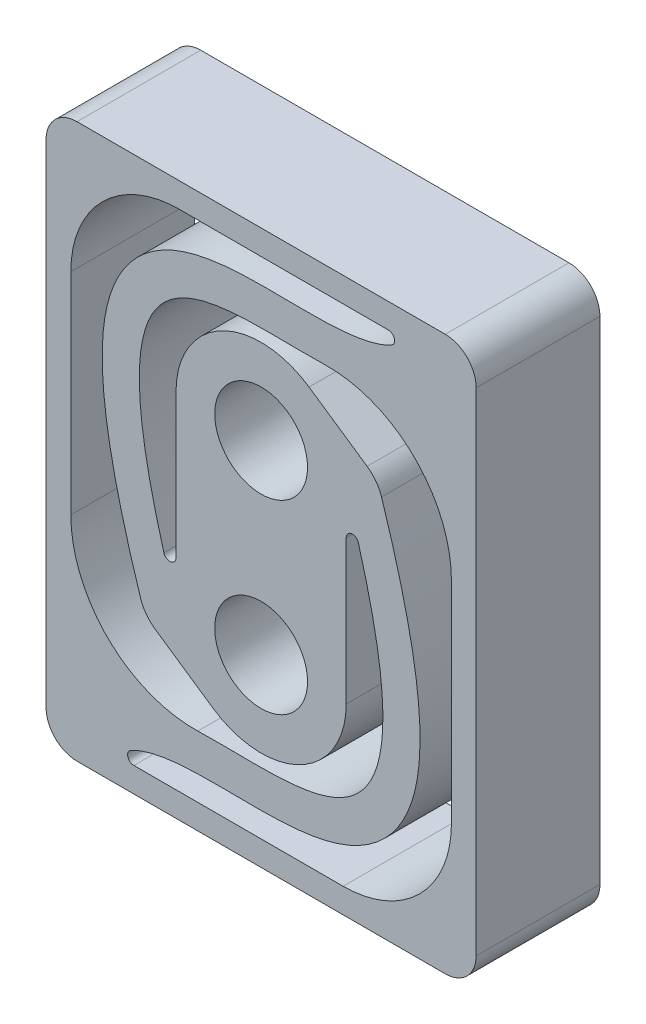
from build123d import *

# Parameters (mm, degrees)
SKETCH1_R           = 1.5
BOSS_EXTRUDE1_DEPTH = 4
SKETCH3_W           = 13.9
SKETCH3_H           = 17.9
BOSS_EXTRUDE2_DEPTH = 4
FILLET1_R           = 1


with BuildPart() as part:
    # Sketch1 → Boss-Extrude1 (new body)
    with BuildSketch(Plane.XY):
        with BuildLine():
            Line((2.75, 3), (2.75, -3))
            ThreePointArc((2.75, -3), (0, -5.75), (-2.75, -3))
            Line((-2.75, -3), (-2.75, 3))
            ThreePointArc((-2.75, 3), (0, 5.75), (2.75, 3))
        make_face()
        with Locations((0, 3)):
            Circle(SKETCH1_R, mode=Mode.SUBTRACT)
        with Locations((0, -3)):
            Circle(SKETCH1_R, mode=Mode.SUBTRACT)
    extrude(amount=BOSS_EXTRUDE1_DEPTH)

    # Sketch3 → Boss-Extrude2 (add)
    # profile 1 of 9: a face of its own
    with BuildSketch(Plane.XY):
        Rectangle(SKETCH3_W, SKETCH3_H)
        with BuildLine():
            ThreePointArc((-6.15, 4.65), (-5.124873734, 7.124873734), (-2.65, 8.15))
            Line((-2.65, 8.15), (4.112856791, 8.15))
            Line((4.112856791, 8.15), (4.706051065, 8.15))
            Line((4.706051065, 8.15), (6.15, 8.15))
            Line((6.15, 8.15), (6.15, 2.154161758))
            Line((6.15, 2.154161758), (6.15, -4.65))
            ThreePointArc((6.15, -4.65), (5.124873734, -7.124873734), (2.65, -8.15))
            Line((2.65, -8.15), (-4.112856791, -8.15))
            Line((-4.112856791, -8.15), (-4.706051065, -8.15))
            Line((-4.706051065, -8.15), (-6.15, -8.15))
            Line((-6.15, -8.15), (-6.15, -2.154161758))
            Line((-6.15, -2.154161758), (-6.15, 4.65))
        make_face(mode=Mode.SUBTRACT)
    # profile 2 of 9: a face of its own
    with BuildSketch(Plane.XY):
        with BuildLine():
            ThreePointArc((-2.75, -1.657276465), (-2.922233335, -1.855339617), (-3.142290123, -1.712271998))
            add(Edge.make_bspline(
                [(-2.75, -3), (-2.895116066, -2.548968307), (-3.025653874, -2.120086915), (-3.142290123, -1.712271998)],
                knots=[0, 0, 0, 0, 0.03046246, 0.03046246, 0.03046246, 0.03046246], degree=3))
            Line((-2.75, -3), (-2.75, -1.657276465))
        make_face()
    # profile 3 of 9: a face of its own
    with BuildSketch(Plane.XY):
        with BuildLine():
            ThreePointArc((2.75, 1.657276465), (2.922233335, 1.855339617), (3.142290123, 1.712271998))
            add(Edge.make_bspline(
                [(2.75, 3), (2.895116066, 2.548968307), (3.025653874, 2.120086915), (3.142290123, 1.712271998)],
                knots=[0, 0, 0, 0, 0.03046246, 0.03046246, 0.03046246, 0.03046246], degree=3))
            Line((2.75, 3), (2.75, 1.657276465))
        make_face()
    # profile 4 of 9: a face of its own
    with BuildSketch(Plane.XY):
        with BuildLine():
            add(Edge.make_bspline(
                [(-2.04403215, -6.152757863), (-3.725432845, -6.197317106), (-5.32078534, -6.499978045), (-6.15, -8.15)],
                knots=[0.694867205, 0.694867205, 0.694867205, 0.694867205, 1, 1, 1, 1], degree=3))
            Line((-6.15, -8.15), (-4.706051065, -8.15))
            add(Edge.make_bspline(
                [(-4.207167317, -7.773632416), (-4.252078901, -7.797648366), (-4.35473853, -7.857185348), (-4.503870008, -7.961266958), (-4.622893022, -8.065250612), (-4.688673957, -8.131740554), (-4.706051065, -8.15)],
                knots=[0.873569037, 0.873569037, 0.873569037, 0.873569037, 0.889194037, 0.910606982, 0.932019927, 0.939832427, 0.939832427, 0.939832427, 0.939832427], degree=3))
            add(Edge.make_bspline(
                [(3.892329753, 3.367536033), (3.966691683, 3.136413539), (4.114564902, 2.664320103), (4.373566525, 1.785097119), (4.645385903, 0.756379468), (4.887449448, -0.359638934), (5.104052776, -1.708671801), (5.181502836, -3.15853137), (4.962795165, -4.614749004), (4.365786787, -5.837691524), (3.403362237, -6.694112805), (2.315936187, -7.134159929), (0.867591801, -7.375395149), (-0.923730528, -7.344095734), (-2.573627433, -7.340372841), (-3.558390207, -7.511577042), (-3.980456832, -7.660053684), (-4.162255733, -7.749616466), (-4.207167317, -7.773632416)],
                knots=[0, 0, 0, 0, 0.015625, 0.03125, 0.0625, 0.09375, 0.125, 0.1875, 0.25, 0.3125, 0.375, 0.4375, 0.5, 0.625, 0.75, 0.8125, 0.857944037, 0.873569037, 0.873569037, 0.873569037, 0.873569037], degree=3))
            ThreePointArc((3.892329753, 3.367536033), (3.711332001, 3.718220568), (3.426363636, 3.991227639))
            Line((3.426363636, 3.991227639), (1.55, 5.271563338))
            ThreePointArc((1.55, 5.271563338), (2.431563283, 4.284523258), (2.75, 3))
            add(Edge.make_bspline(
                [(2.75, 3), (2.895116066, 2.548968307), (3.025653874, 2.120086915), (3.142290123, 1.712271998)],
                knots=[0, 0, 0, 0, 0.03046246, 0.03046246, 0.03046246, 0.03046246], degree=3))
            add(Edge.make_bspline(
                [(3.142290123, 1.712271998), (5.686197488, -7.182418828), (1.61709709, -6.055733312), (-2.04403215, -6.152757863)],
                knots=[0.03046246, 0.03046246, 0.03046246, 0.03046246, 0.694867205, 0.694867205, 0.694867205, 0.694867205], degree=3))
        make_face()
    # profile 5 of 9: a face of its own
    with BuildSketch(Plane.XY):
        with BuildLine():
            Line((6.15, 2.154161758), (6.15, 8.15))
            add(Edge.make_bspline(
                [(2.04403215, 6.152757863), (3.725432845, 6.197317106), (5.32078534, 6.499978045), (6.15, 8.15)],
                knots=[0.694867205, 0.694867205, 0.694867205, 0.694867205, 1, 1, 1, 1], degree=3))
            ThreePointArc((2.04403215, 6.152757863), (4.940710358, 5.019809276), (6.15, 2.154161758))
        make_face()
    # profile 6 of 9: a face of its own
    with BuildSketch(Plane.XY):
        with BuildLine():
            ThreePointArc((-2.04403215, -6.152757863), (-4.940710358, -5.019809276), (-6.15, -2.154161758))
            Line((-6.15, -2.154161758), (-6.15, -8.15))
            add(Edge.make_bspline(
                [(-2.04403215, -6.152757863), (-3.725432845, -6.197317106), (-5.32078534, -6.499978045), (-6.15, -8.15)],
                knots=[0.694867205, 0.694867205, 0.694867205, 0.694867205, 1, 1, 1, 1], degree=3))
        make_face()
    # profile 7 of 9: a face of its own
    with BuildSketch(Plane.XY):
        with BuildLine():
            Line((6.15, 8.15), (4.706051065, 8.15))
            add(Edge.make_bspline(
                [(4.207167317, 7.773632416), (4.252078901, 7.797648366), (4.35473853, 7.857185348), (4.503870008, 7.961266958), (4.622893022, 8.065250612), (4.688673957, 8.131740554), (4.706051065, 8.15)],
                knots=[0.873569037, 0.873569037, 0.873569037, 0.873569037, 0.889194037, 0.910606982, 0.932019927, 0.939832427, 0.939832427, 0.939832427, 0.939832427], degree=3))
            add(Edge.make_bspline(
                [(-3.892329753, -3.367536033), (-3.966691683, -3.136413539), (-4.114564902, -2.664320103), (-4.373566525, -1.785097119), (-4.645385903, -0.756379468), (-4.887449448, 0.359638934), (-5.104052776, 1.708671801), (-5.181502836, 3.15853137), (-4.962795165, 4.614749004), (-4.365786787, 5.837691524), (-3.403362237, 6.694112805), (-2.315936187, 7.134159929), (-0.867591801, 7.375395149), (0.923730528, 7.344095734), (2.573627433, 7.340372841), (3.558390207, 7.511577042), (3.980456832, 7.660053684), (4.162255733, 7.749616466), (4.207167317, 7.773632416)],
                knots=[0, 0, 0, 0, 0.015625, 0.03125, 0.0625, 0.09375, 0.125, 0.1875, 0.25, 0.3125, 0.375, 0.4375, 0.5, 0.625, 0.75, 0.8125, 0.857944037, 0.873569037, 0.873569037, 0.873569037, 0.873569037], degree=3))
            ThreePointArc((-3.892329753, -3.367536033), (-3.711332001, -3.718220568), (-3.426363636, -3.991227639))
            Line((-3.426363636, -3.991227639), (-1.55, -5.271563338))
            ThreePointArc((-1.55, -5.271563338), (-2.431563283, -4.284523258), (-2.75, -3))
            add(Edge.make_bspline(
                [(-2.75, -3), (-2.895116066, -2.548968307), (-3.025653874, -2.120086915), (-3.142290123, -1.712271998)],
                knots=[0, 0, 0, 0, 0.03046246, 0.03046246, 0.03046246, 0.03046246], degree=3))
            add(Edge.make_bspline(
                [(-3.142290123, -1.712271998), (-5.686197488, 7.182418828), (-1.61709709, 6.055733312), (2.04403215, 6.152757863)],
                knots=[0.03046246, 0.03046246, 0.03046246, 0.03046246, 0.694867205, 0.694867205, 0.694867205, 0.694867205], degree=3))
            add(Edge.make_bspline(
                [(2.04403215, 6.152757863), (3.725432845, 6.197317106), (5.32078534, 6.499978045), (6.15, 8.15)],
                knots=[0.694867205, 0.694867205, 0.694867205, 0.694867205, 1, 1, 1, 1], degree=3))
        make_face()
    # profile 8 of 9: a face of its own
    with BuildSketch(Plane.XY):
        with BuildLine():
            ThreePointArc((4.112856791, 8.15), (4.306858746, 7.998613183), (4.207167317, 7.773632416))
            add(Edge.make_bspline(
                [(4.207167317, 7.773632416), (4.252078901, 7.797648366), (4.35473853, 7.857185348), (4.503870008, 7.961266958), (4.622893022, 8.065250612), (4.688673957, 8.131740554), (4.706051065, 8.15)],
                knots=[0.873569037, 0.873569037, 0.873569037, 0.873569037, 0.889194037, 0.910606982, 0.932019927, 0.939832427, 0.939832427, 0.939832427, 0.939832427], degree=3))
            Line((4.706051065, 8.15), (4.112856791, 8.15))
        make_face()
    # profile 9 of 9: a face of its own
    with BuildSketch(Plane.XY):
        with BuildLine():
            ThreePointArc((-4.112856791, -8.15), (-4.306858746, -7.998613183), (-4.207167317, -7.773632416))
            add(Edge.make_bspline(
                [(-4.207167317, -7.773632416), (-4.252078901, -7.797648366), (-4.35473853, -7.857185348), (-4.503870008, -7.961266958), (-4.622893022, -8.065250612), (-4.688673957, -8.131740554), (-4.706051065, -8.15)],
                knots=[0.873569037, 0.873569037, 0.873569037, 0.873569037, 0.889194037, 0.910606982, 0.932019927, 0.939832427, 0.939832427, 0.939832427, 0.939832427], degree=3))
            Line((-4.706051065, -8.15), (-4.112856791, -8.15))
        make_face()
    extrude(amount=BOSS_EXTRUDE2_DEPTH)

    # Fillet1
    fillet1_edges = [part.edges().sort_by_distance(p)[0] for p in [
        (6.95, 8.95, 2),
        (-6.95, 8.95, 2),
        (-6.95, -8.95, 2),
        (6.95, -8.95, 2),
    ]]
    fillet(fillet1_edges, radius=FILLET1_R)


solid = part.part
